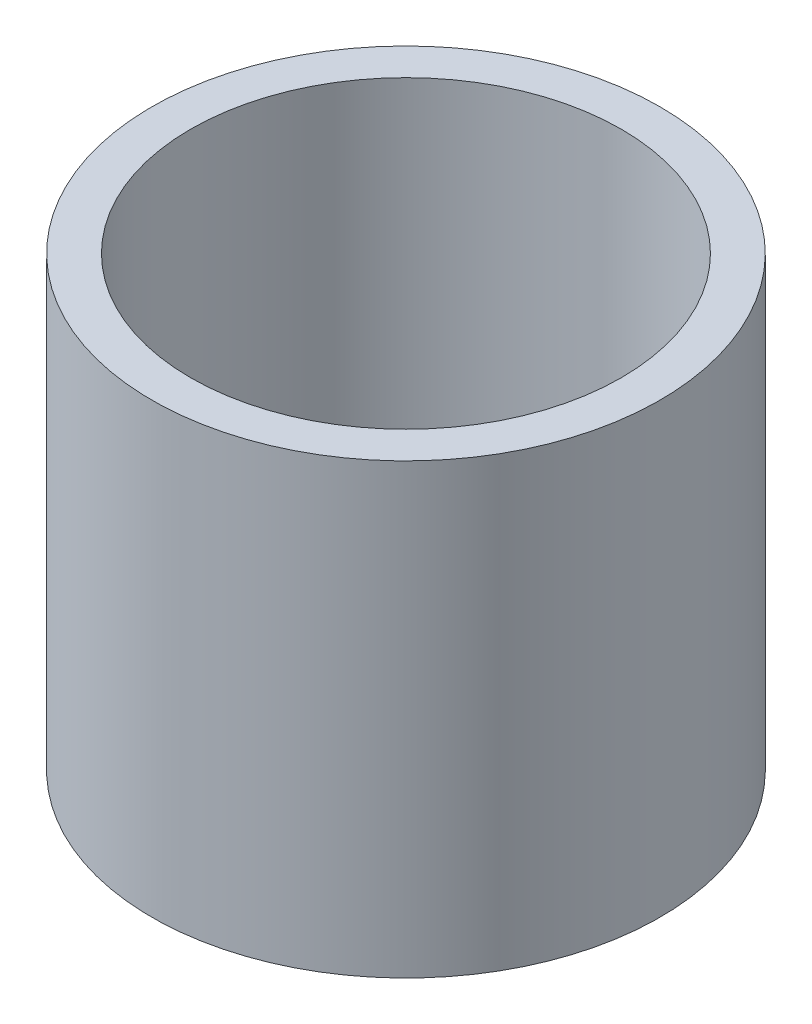
from build123d import *

# Parameters (mm, degrees)
SKETCH_1_W = 4.5
SKETCH_1_H = 52


with BuildPart() as part:
    # Эскиз1 → Повернуть1 (revolve)
    with BuildSketch(Plane.XY, mode=Mode.PRIVATE) as revolve_1_sk:
        with Locations((-27.25, 26)):
            Rectangle(SKETCH_1_W, SKETCH_1_H)
    revolve(revolve_1_sk.sketch.rotate(Axis((0, 0, 0), (0, 1, 0)), 270), axis=Axis((0, 0, 0), (0, 1, 0)))


solid = part.part
